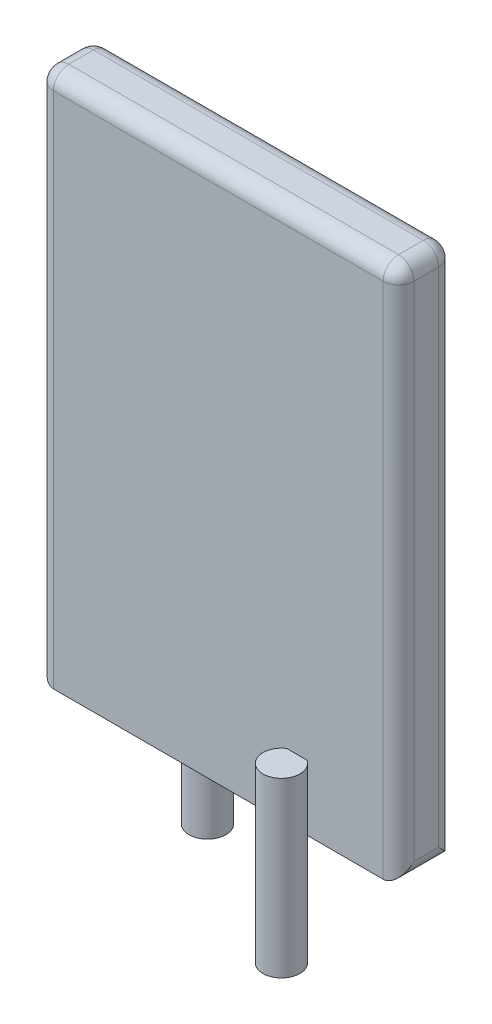
from build123d import *

# Parameters (mm, degrees)
SKETCH_1_W      = 11.7
SKETCH_1_H      = 17.3
EXTRUDE_1_DEPTH = 0.9
FILLET_1_R      = 0.5
SKETCH_3_W      = 0.6
SKETCH_3_H      = 5.609535621


with BuildPart() as part:
    # Эскиз1 → Бобышка-Вытянуть1 (new, symmetric)
    with BuildSketch(Plane.XY):
        Rectangle(SKETCH_1_W, SKETCH_1_H)
    extrude(amount=EXTRUDE_1_DEPTH, both=True)

    # Скругление1
    fillet_1_edges = [part.edges().sort_by_distance(p)[0] for p in [
        (5.85, 0, 0.9),
        (0, 8.65, 0.9),
        (-5.85, 0, 0.9),
        (0, 8.65, -0.9),
        (5.85, 0, -0.9),
        (-5.85, 0, -0.9),
        (-5.85, 8.65, 0),
        (5.85, 8.65, 0),
        (5.85, -8.65, 0),
        (-5.85, -8.65, 0),
    ]]
    fillet(fillet_1_edges, radius=FILLET_1_R)


with BuildPart() as body_2:
    # Эскиз3 → Повернуть2 (revolve)
    with BuildSketch(Plane(origin=(2.55, 0, 0), x_dir=(0, 0, -1), z_dir=(1, 0, 0)), mode=Mode.PRIVATE) as revolve_2_sk:
        with Locations((-1.1, -9.34523219)):
            Rectangle(SKETCH_3_W, SKETCH_3_H)
    revolve(revolve_2_sk.sketch.rotate(Axis((2.55, -2.222678483, 1.4), (0, -1, 0)), 180), axis=Axis((2.55, -2.222678483, 1.4), (0, -1, 0)))


with BuildPart() as body_3:
    # Move Body 1: copy of body 2
    add(body_2.part.moved(Location((-5.1, 0, -2.7))))


solid = Compound([part.part, body_2.part, body_3.part])
